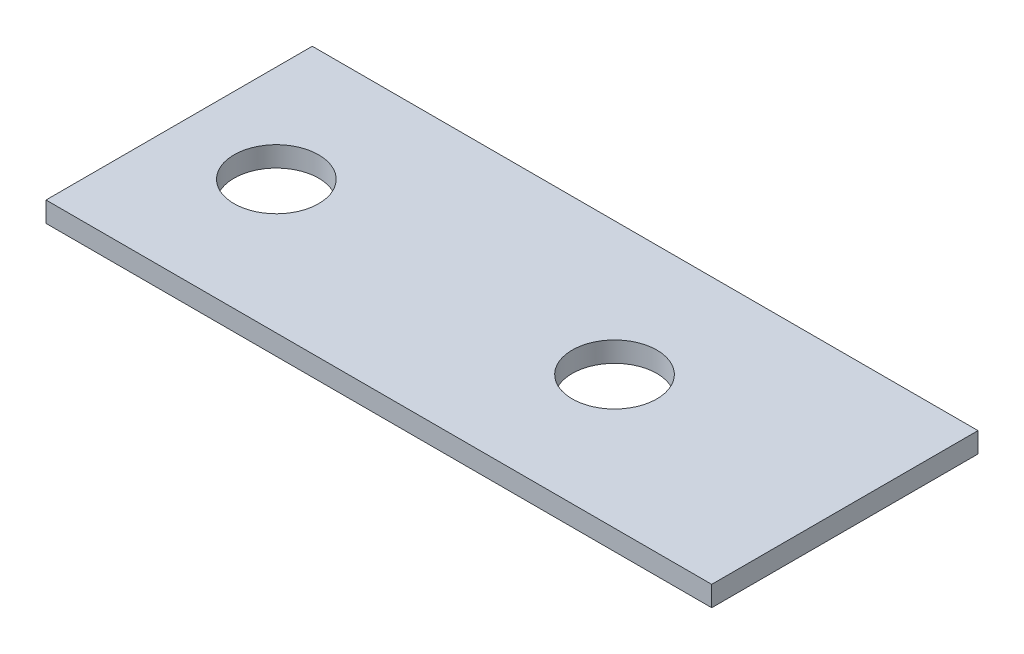
from build123d import *

# Parameters (mm, degrees)
SKETCH1_W           = 20
SKETCH1_H           = 10
SKETCH1_R           = 1.59
SKETCH1_W_2         = 5
BOSS_EXTRUDE1_DEPTH = 0.762


with BuildPart() as part:
    # Sketch1 → Boss-Extrude1 (new body)
    # profile 1 of 2: a face of its own
    with BuildSketch(Plane(origin=(0, 0, 0), x_dir=(1, 0, 0), z_dir=(0, 1, 0))):
        with Locations((6.35, 0)):
            Rectangle(SKETCH1_W, SKETCH1_H)
        with Locations(Location((0, 0, 0), (0, 0, 90))):
            Circle(SKETCH1_R, mode=Mode.SUBTRACT)
        with Locations(Location((12.7, 0, 0), (0, 0, 90))):
            Circle(SKETCH1_R, mode=Mode.SUBTRACT)
    # profile 2 of 2: a face of its own
    with BuildSketch(Plane(origin=(0, 0, 0), x_dir=(1, 0, 0), z_dir=(0, 1, 0))):
        with Locations((18.85, 0)):
            Rectangle(SKETCH1_W_2, SKETCH1_H)
    extrude(amount=BOSS_EXTRUDE1_DEPTH)


solid = part.part
